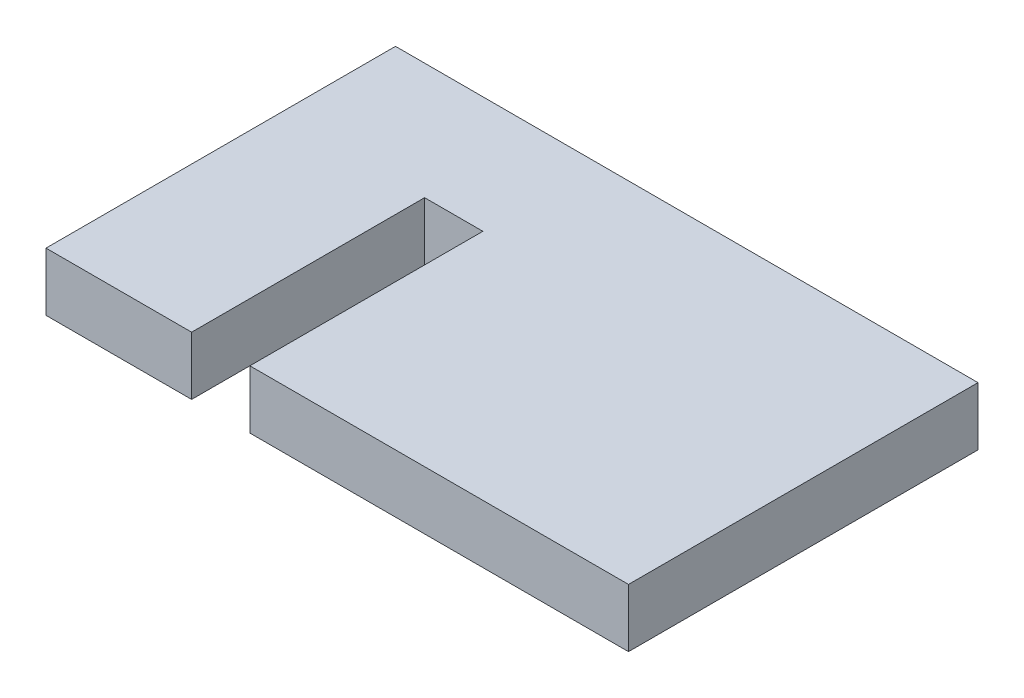
from build123d import *

# Parameters (mm, degrees)
SKETCH2_W           = 63.5
SKETCH2_H           = 38.1
BOSS_EXTRUDE1_DEPTH = 6.35
SKETCH3_W           = 6.35
SKETCH3_H           = 25.4
CUT_EXTRUDE1_DEPTH  = 75.324844433


with BuildPart() as part:
    # Sketch2 → Boss-Extrude1 (new body)
    with BuildSketch(Plane(origin=(0, 0, 0), x_dir=(1, 0, 0), z_dir=(0, 1, 0))):
        with Locations((31.75, 19.05)):
            Rectangle(SKETCH2_W, SKETCH2_H)
    extrude(amount=BOSS_EXTRUDE1_DEPTH)

    # Sketch3 → Cut-Extrude1 (cut, through all)
    with BuildSketch(Plane.XZ):
        with Locations((19.05, -12.7)):
            Rectangle(SKETCH3_W, SKETCH3_H)
    extrude(amount=-CUT_EXTRUDE1_DEPTH, mode=Mode.SUBTRACT)


solid = part.part
